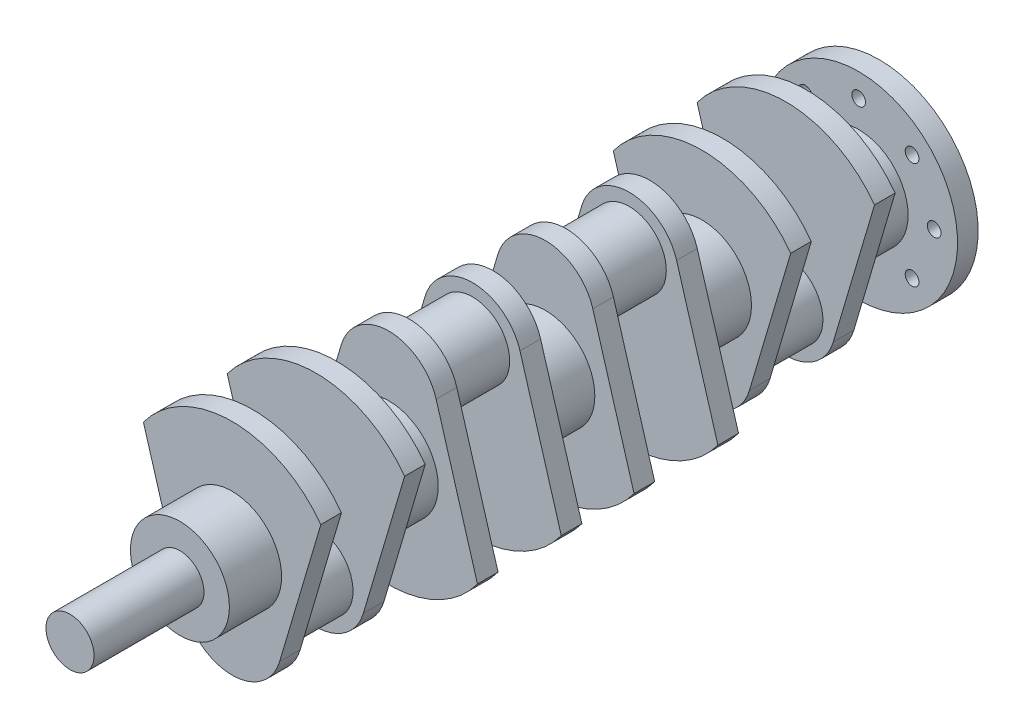
from build123d import *

# Parameters (mm, degrees)
BOSS_EXTRUDE1_DEPTH   = 15
SKETCH2_R             = 27
BOSS_EXTRUDE2_DEPTH   = 46
SKETCH3_R             = 36
BOSS_EXTRUDE3_DEPTH   = 38
BODY_MOVE_COPY1_ANGLE = 180
SKETCH4_R             = 17.5
BOSS_EXTRUDE4_DEPTH   = 80
SKETCH6_R             = 72
SKETCH6_R_2           = 5
BOSS_EXTRUDE5_DEPTH   = 15


with BuildPart() as part:
    # Sketch1 → Boss-Extrude1 (new body)
    with BuildSketch(Plane.XY):
        with BuildLine():
            ThreePointArc((64.569893475, 47.23059238), (0, 80), (-64.569893475, 47.23059238))
            Line((-64.569893475, 47.23059238), (-34.517510455, -54.224552409))
            ThreePointArc((-34.517510455, -54.224552409), (0, -80), (34.517510455, -54.224552409))
            Line((34.517510455, -54.224552409), (64.569893475, 47.23059238))
        make_face()
    boss_extrude1 = extrude(amount=BOSS_EXTRUDE1_DEPTH)

    # Sketch2 → Boss-Extrude2 (add)
    with BuildSketch(Plane(origin=(0, 0, 0), x_dir=(-1, 0, 0), z_dir=(0, 0, -1))):
        with Locations((0, -44)):
            Circle(SKETCH2_R)
    extrude(amount=BOSS_EXTRUDE2_DEPTH)

    # Sketch3 → Boss-Extrude3 (add)
    with BuildSketch(Plane.XY.offset(15)):
        Circle(SKETCH3_R)
    boss_extrude3 = extrude(amount=BOSS_EXTRUDE3_DEPTH)

    # Mirror1: Boss-Extrude1, Boss-Extrude3 across plane
    add(boss_extrude1.mirror(Plane(origin=(0, 0, -23), x_dir=(1, 0, 0), z_dir=(0, 0, -1))))
    add(boss_extrude3.mirror(Plane(origin=(0, 0, -23), x_dir=(1, 0, 0), z_dir=(0, 0, -1))))


with BuildPart() as body_2:
    # Mirror3: mirrored copy
    add(part.part.mirror(Plane(origin=(0, 0, -80), x_dir=(1, 0, 0), z_dir=(0, 0, -1))))


with BuildPart() as body_2_1:
    # Body-Move/Copy1: moved
    add(body_2.part.rotate(Axis((0, 0, -137), (1, 0, 0)), BODY_MOVE_COPY1_ANGLE))


with BuildPart() as body_3:
    # Mirror4: mirrored copy
    add(part.part.mirror(Plane(origin=(0, 0, -194), x_dir=(1, 0, 0), z_dir=(0, 0, -1))))


with BuildPart() as body_4:
    # Mirror4 2: mirrored copy
    add(body_2_1.part.mirror(Plane(origin=(0, 0, -194), x_dir=(1, 0, 0), z_dir=(0, 0, -1))))


with BuildPart() as part_1:
    add(part.part)

    # Sketch4 → Boss-Extrude4 (add)
    with BuildSketch(Plane.XY.offset(53)):
        Circle(SKETCH4_R)
    extrude(amount=BOSS_EXTRUDE4_DEPTH)

    # Combine1: union body 2, body 4, body 3
    add(body_2_1.part)
    add(body_4.part)
    add(body_3.part)


with BuildPart() as body_5:
    # Sketch6 → Boss-Extrude5 (new body)
    with BuildSketch(Plane(origin=(0, 0, -441), x_dir=(-1, 0, 0), z_dir=(0, 0, -1))):
        with Locations((0, 0.564795364)):
            Circle(SKETCH6_R)
        with Locations((0, 55.564795364)):
            Circle(SKETCH6_R_2, mode=Mode.SUBTRACT)
        with Locations((38.890872965, 39.455668329)):
            Circle(SKETCH6_R_2, mode=Mode.SUBTRACT)
        with Locations((55, 0.564795364)):
            Circle(SKETCH6_R_2, mode=Mode.SUBTRACT)
        with Locations((38.890872965, -38.326077602)):
            Circle(SKETCH6_R_2, mode=Mode.SUBTRACT)
        with Locations((0, -54.435204636)):
            Circle(SKETCH6_R_2, mode=Mode.SUBTRACT)
        with Locations((-38.890872965, -38.326077602)):
            Circle(SKETCH6_R_2, mode=Mode.SUBTRACT)
        with Locations((-55, 0.564795364)):
            Circle(SKETCH6_R_2, mode=Mode.SUBTRACT)
        with Locations((-38.890872965, 39.455668329)):
            Circle(SKETCH6_R_2, mode=Mode.SUBTRACT)
    extrude(amount=BOSS_EXTRUDE5_DEPTH)


solid = Compound([part_1.part, body_5.part])
